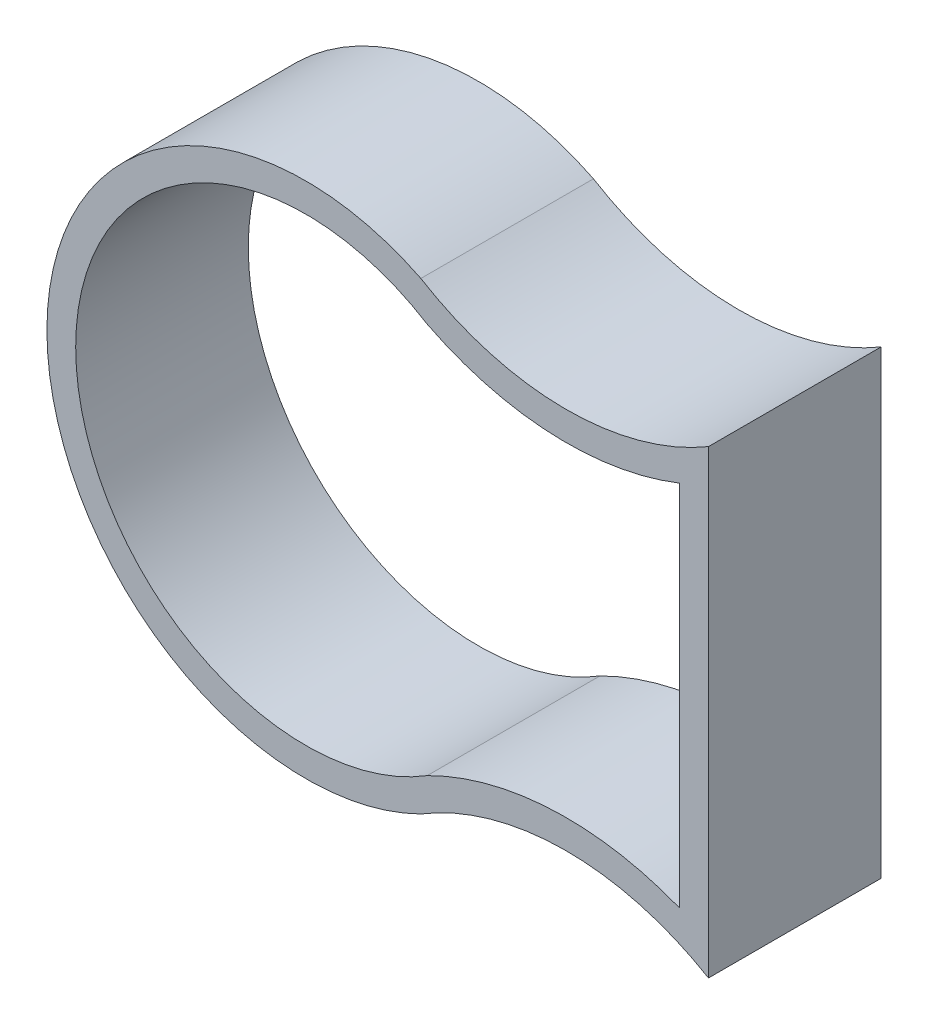
from build123d import *

# Parameters (mm, degrees)
BOSS_EXTRUDE1_DEPTH = 38.1


with BuildPart() as part:
    # Sketch1 → Boss-Extrude1 (new body)
    with BuildSketch(Plane.XY):
        with BuildLine():
            Line((88.9, -50.8), (88.9, 50.8))
            ThreePointArc((88.9, 50.8), (57.095135122, 42.185130239), (25.4, 51.195336702))
            ThreePointArc((25.4, 51.195336702), (-57.15, 0), (25.4, -51.195336702))
            ThreePointArc((25.4, -51.195336702), (57.095135122, -42.185130239), (88.9, -50.8))
        make_face()
        with BuildLine():
            ThreePointArc((82.55, -40.628164989), (54.413891048, -35.903084421), (26.818032813, -43.144328898))
            ThreePointArc((26.818032813, -43.144328898), (24.611630749, -44.439932852), (22.342791686, -45.622797587))
            ThreePointArc((22.342791686, -45.622797587), (-50.735562995, 2.557859955), (26.818032813, 43.144328898))
            ThreePointArc((26.818032813, 43.144328898), (54.413891048, 35.903084421), (82.55, 40.628164989))
            Line((82.55, 40.628164989), (82.55, -40.628164989))
        make_face(mode=Mode.SUBTRACT)
    extrude(amount=BOSS_EXTRUDE1_DEPTH)


solid = part.part
